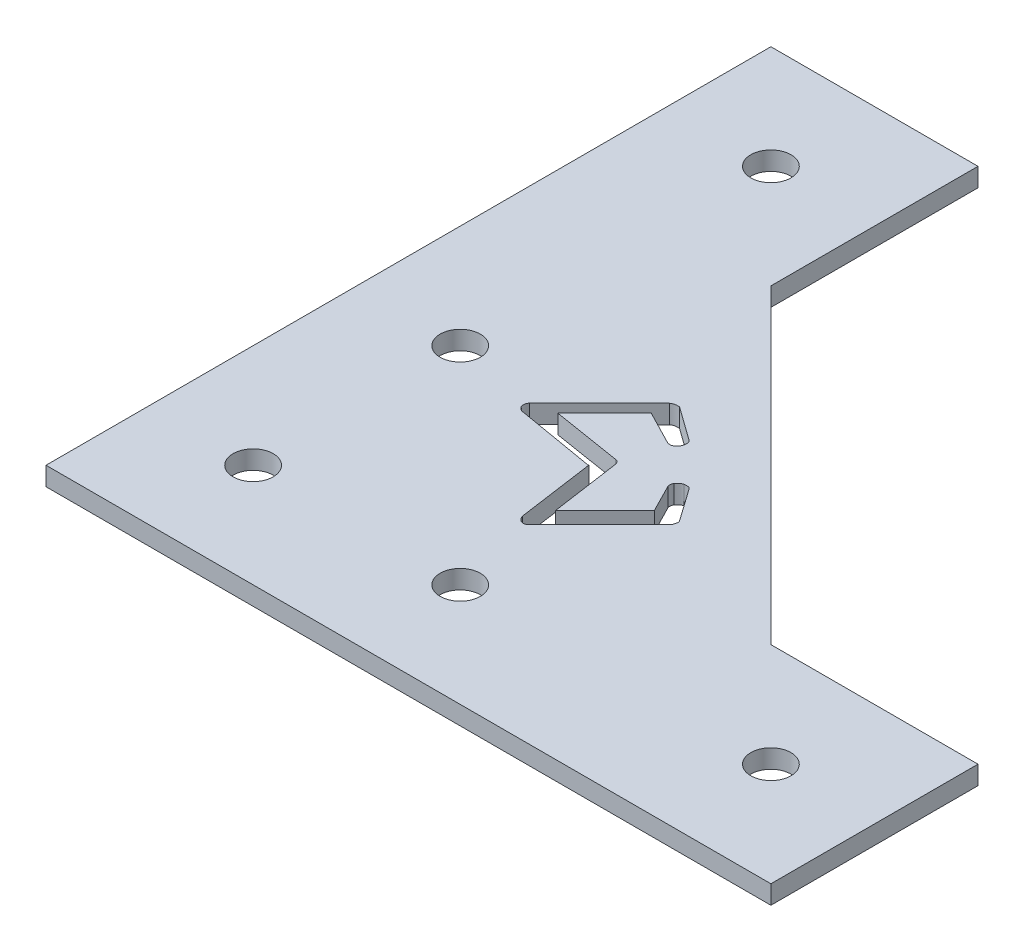
from build123d import *

# Parameters (mm, degrees)
BOSS_EXTRUDE1_DEPTH = 2.286
CUT_EXTRUDE1_DEPTH  = 126.744366856
SKETCH3_R           = 2.4638
CUT_EXTRUDE2_DEPTH  = 126.744366999


with BuildPart() as part:
    # Sketch1 → Boss-Extrude1 (new body)
    with BuildSketch(Plane(origin=(0, 0, 0), x_dir=(1, 0, 0), z_dir=(0, 1, 0))):
        Polygon((25.4, 63.5), (63.5, 25.4), (88.9, 25.4), (88.9, 0), (0, 0), (0, 88.9), (25.4, 88.9), align=None)
    extrude(amount=BOSS_EXTRUDE1_DEPTH)

    # Sketch2 → Cut-Extrude1 (cut, through all)
    with BuildSketch(Plane(origin=(0, 2.286, 0), x_dir=(1, 0, 0), z_dir=(0, 1, 0))):
        with BuildLine():
            add(Edge.make_bspline(
                [(31.65582917, 44.824706507), (31.72721015, 44.868168803), (31.870288171, 44.955285838), (32.115061475, 45.030799557), (32.37800112, 45.066201469), (32.558110333, 45.05330926), (32.651195267, 45.046646245)],
                knots=[0, 0, 0, 0, 0.959878879, 1.924007909, 2.927075513, 4, 4, 4, 4], degree=3))
            Line((32.651195267, 45.046646245), (36.831060331, 42.050459784))
            add(Edge.make_bspline(
                [(36.831060331, 42.050459784), (36.874582097, 41.996816639), (36.963947184, 41.886668896), (37.019807322, 41.663032648), (36.998735396, 41.406700154), (36.946797609, 41.231360456), (36.918491136, 41.135799046)],
                knots=[0, 0, 0, 0, 0.847093379, 1.739372747, 2.767941704, 4, 4, 4, 4], degree=3))
            add(Edge.make_bspline(
                [(36.918491136, 41.135799046), (36.907659111, 41.100371643), (36.884120075, 41.023384482), (36.811679346, 40.91436251), (36.720386672, 40.794599967), (36.64589915, 40.716950958), (36.605757869, 40.675105953)],
                knots=[0, 0, 0, 0, 0.786237394, 1.708569685, 2.765149586, 4, 4, 4, 4], degree=3))
            add(Edge.make_bspline(
                [(36.605757869, 40.675105953), (36.534614921, 40.6177911), (36.384603144, 40.496937196), (36.196750402, 40.452821185), (36.097986651, 40.429627152)],
                knots=[0, 0, 0, 0, 0.948498166, 2, 2, 2, 2], degree=3))
            Line((36.097986651, 40.429627152), (35.778527937, 40.480068002))
            Line((35.778527937, 40.480068002), (31.58521198, 42.642299085))
            Line((31.58521198, 42.642299085), (25.855131474, 36.912218579))
            Line((25.855131474, 36.912218579), (34.315743301, 35.546952919))
            add(Edge.make_bspline(
                [(34.315743301, 35.546952919), (34.378329612, 35.529086939), (34.490251228, 35.497137631), (34.593189369, 35.443023199), (34.638564738, 35.419169433)],
                knots=[0, 0, 0, 0, 1.11839541, 2, 2, 2, 2], degree=3))
            add(Edge.make_bspline(
                [(34.638564738, 35.419169433), (34.683076904, 35.345786024), (34.768509207, 35.204941079), (34.807974339, 35.045116744), (34.826877243, 34.968564511)],
                knots=[0, 0, 0, 0, 1.042045342, 2, 2, 2, 2], degree=3))
            Line((34.826877243, 34.968564511), (36.050908525, 26.447423665))
            Line((36.050908525, 26.447423665), (42.107173191, 32.503688331))
            Line((42.107173191, 32.503688331), (40.361919797, 35.923577928))
            add(Edge.make_bspline(
                [(40.361919797, 35.923577928), (40.351753136, 35.974985176), (40.330871112, 36.080574163), (40.3439389, 36.246210329), (40.367095634, 36.421433735), (40.407855126, 36.536130678), (40.429174263, 36.596122589)],
                knots=[0, 0, 0, 0, 0.913209557, 1.875705789, 2.888893945, 4, 4, 4, 4], degree=3))
            add(Edge.make_bspline(
                [(40.429174263, 36.596122589), (40.509009346, 36.672362665), (40.651215954, 36.808165651), (40.849356719, 36.972690697), (41.015708613, 37.074515143), (41.12005501, 37.088251343), (41.162247943, 37.093805637)],
                knots=[0, 0, 0, 0, 1.466202942, 2.611680716, 3.438626887, 4, 4, 4, 4], degree=3))
            add(Edge.make_bspline(
                [(41.162247943, 37.093805637), (41.243888372, 37.10647383), (41.393272638, 37.129653873), (41.601794633, 37.125883922), (41.776610643, 37.083447982), (41.862114812, 37.017157534), (41.902047069, 36.986198492)],
                knots=[0, 0, 0, 0, 1.278063421, 2.338578655, 3.224081066, 4, 4, 4, 4], degree=3))
            Line((41.902047069, 36.986198492), (44.777175492, 32.913940573))
            add(Edge.make_bspline(
                [(44.777175492, 32.913940573), (44.794644521, 32.874178054), (44.836759395, 32.778317344), (44.821784918, 32.589132207), (44.777454045, 32.347784995), (44.719281585, 32.170283543), (44.686381963, 32.069897025)],
                knots=[0, 0, 0, 0, 0.592454987, 1.428308758, 2.545571737, 4, 4, 4, 4], degree=3))
            Line((44.686381963, 32.069897025), (35.876046913, 23.259561975))
            add(Edge.make_bspline(
                [(35.876046913, 23.259561975), (35.802583462, 23.210319908), (35.662434184, 23.11637877), (35.410146741, 23.084728901), (35.156417578, 23.137802986), (35.012256253, 23.238737342), (34.934484389, 23.293189208)],
                knots=[0, 0, 0, 0, 1.024762661, 1.954982311, 2.896757927, 4, 4, 4, 4], degree=3))
            add(Edge.make_bspline(
                [(34.934484389, 23.293189208), (34.862211763, 23.371249908), (34.725830705, 23.518553272), (34.655031564, 23.706083117), (34.621751121, 23.79423498)],
                knots=[0, 0, 0, 0, 1.059863105, 2, 2, 2, 2], degree=3))
            Line((34.621751121, 23.79423498), (33.269936354, 33.337643709))
            Line((33.269936354, 33.337643709), (33.212770058, 33.260301073))
            Line((33.212770058, 33.260301073), (23.370078955, 34.945025448))
            add(Edge.make_bspline(
                [(23.370078955, 34.945025448), (23.325591172, 34.969657633), (23.229222166, 35.023015636), (23.143726057, 35.092543958), (23.097698367, 35.129975229)],
                knots=[0, 0, 0, 0, 0.923279883, 2, 2, 2, 2], degree=3))
            add(Edge.make_bspline(
                [(23.097698367, 35.129975229), (23.056477465, 35.174430553), (22.978267135, 35.258777702), (22.896457595, 35.403808998), (22.845356477, 35.551168549), (22.835942364, 35.750716315), (22.882407019, 36.001780496), (22.991741999, 36.170711674), (23.047257518, 36.256487535)],
                knots=[0, 0, 0, 0, 0.874892655, 1.659974428, 2.393902707, 3.109661626, 4.532412633, 6, 6, 6, 6], degree=3))
            Line((23.047257518, 36.256487535), (31.65582917, 44.824706507))
        make_face()
    extrude(amount=-CUT_EXTRUDE1_DEPTH, mode=Mode.SUBTRACT)

    # Sketch3 → Cut-Extrude2 (cut, through all)
    with BuildSketch(Plane(origin=(0, 2.286, 0), x_dir=(1, 0, 0), z_dir=(0, 1, 0))):
        with Locations(Location((76.2, 12.7, 0), (0, 0, 270))):
            Circle(SKETCH3_R)
        with Locations(Location((12.7, 12.7, 0), (0, 0, 270))):
            Circle(SKETCH3_R)
        with Locations(Location((12.7, 76.2, 0), (0, 0, 270))):
            Circle(SKETCH3_R)
        with Locations(Location((12.7, 38.1, 0), (0, 0, 270))):
            Circle(SKETCH3_R)
        with Locations(Location((38.1, 12.7, 0), (0, 0, 270))):
            Circle(SKETCH3_R)
    extrude(amount=-CUT_EXTRUDE2_DEPTH, mode=Mode.SUBTRACT)


solid = part.part
